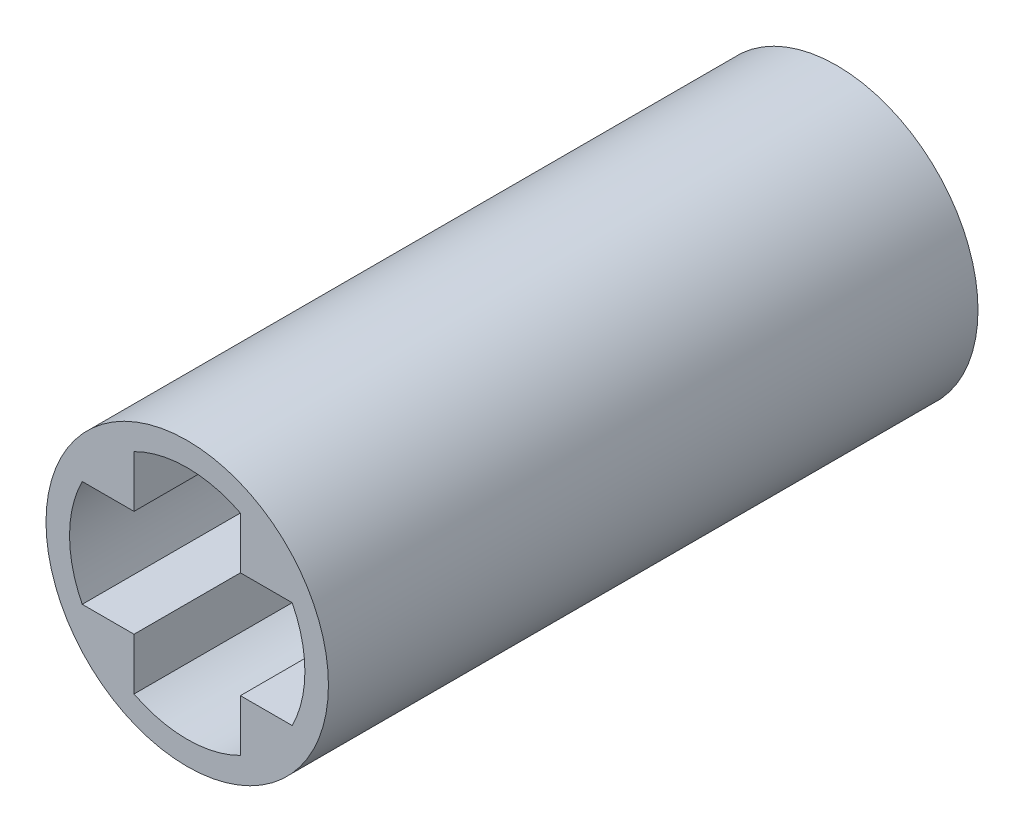
from build123d import *

# Parameters (mm, degrees)
SKETCH_1_R               = 3
SKETCH_1_R_2             = 1.5625
EXTRUDE_1_DEPTH          = 5
CUT_EXTRUDE_2_DEPTH      = 7.557438524
PATTERN_CIRCULAR_1_COUNT = 7
SKETCH_2_R               = 3
EXTRUDE_2_DEPTH          = 8.8
CUT_EXTRUDE_START        = 8.8
CUT_EXTRUDE_3_DEPTH      = 7.8


with BuildPart() as part:
    # 草图1 → 凸台-拉伸1 (new body)
    with BuildSketch(Plane.XY):
        Circle(SKETCH_1_R)
        Circle(SKETCH_1_R_2, mode=Mode.SUBTRACT)
    extrude(amount=EXTRUDE_1_DEPTH)

    # 草图1<3> → 切除-拉伸2 (cut, through all)
    with BuildSketch(Plane.XY):
        with BuildLine():
            Line((1.473941588, 0.729213103), (1.40047846, 0.692868192))
            ThreePointArc((1.40047846, 0.692868192), (1.521455528, 0.355779887), (1.5625, 0))
            ThreePointArc((1.5625, 0), (1.521455528, -0.355779887), (1.40047846, -0.692868192))
            Line((1.40047846, -0.692868192), (1.473941588, -0.729213103))
            add(Edge.make_bspline(
                [(1.473941588, -0.729213103), (1.485175683, -0.734771023), (1.517731995, -0.74785023), (1.58325759, -0.763025647), (1.69185053, -0.772739945), (1.833066262, -0.76334643), (2.010800821, -0.725727848), (2.210262557, -0.650798613), (2.403274907, -0.54458002), (2.544769721, -0.44101945), (2.63009006, -0.368231772), (2.666526001, -0.335104965)],
                knots=[0, 0, 0, 0, 0, 0.005604068, 0.015718248, 0.029959916, 0.048733667, 0.068727063, 0.096888892, 0.125050566, 0.147116643, 0.147116643, 0.147116643, 0.147116643, 0.147116643], degree=4))
            ThreePointArc((2.666526001, -0.335104965), (2.682251375, -0.167880349), (2.6875, 0))
            ThreePointArc((2.6875, 0), (2.682251375, 0.167880349), (2.666526001, 0.335104965))
            add(Edge.make_bspline(
                [(1.473941588, 0.729213103), (1.485175683, 0.734771023), (1.517731995, 0.74785023), (1.58325759, 0.763025647), (1.69185053, 0.772739945), (1.833066262, 0.76334643), (2.010800821, 0.725727848), (2.210262557, 0.650798613), (2.403274907, 0.54458002), (2.544769721, 0.44101945), (2.63009006, 0.368231772), (2.666526001, 0.335104965)],
                knots=[0, 0, 0, 0, 0, 0.005604068, 0.015718248, 0.029959916, 0.048733667, 0.068727063, 0.096888892, 0.125050566, 0.147116643, 0.147116643, 0.147116643, 0.147116643, 0.147116643], degree=4))
        make_face()
    cut_extrude_2 = extrude(amount=CUT_EXTRUDE_2_DEPTH, mode=Mode.SUBTRACT)

    # 阵列(圆周)1: 切除-拉伸2 ×7 about axis
    pattern_circular_1_axis = Axis((0, 0, 5), (0, 0, 1))
    for i in range(1, PATTERN_CIRCULAR_1_COUNT):
        add(cut_extrude_2.rotate(pattern_circular_1_axis, i * 360 / PATTERN_CIRCULAR_1_COUNT), mode=Mode.SUBTRACT)

    # 草图2 → 凸台-拉伸2 (add)
    with BuildSketch(Plane.XY.offset(5)):
        Circle(SKETCH_2_R)
    extrude(amount=EXTRUDE_2_DEPTH)

    # 草图2<4> → 切除-拉伸3 (cut)
    with BuildSketch(Plane.XY.offset(5).offset(CUT_EXTRUDE_START)):
        with BuildLine():
            ThreePointArc((1.130029762, 2.230029762), (0, 2.5), (-1.130029762, 2.230029762))
            Line((-1.130029762, 2.230029762), (-1.130029762, 1.130029762))
            Line((-1.130029762, 1.130029762), (-2.230029762, 1.130029762))
            ThreePointArc((-2.230029762, 1.130029762), (-2.5, 0), (-2.230029762, -1.130029762))
            Line((-2.230029762, -1.130029762), (-1.130029762, -1.130029762))
            Line((-1.130029762, -1.130029762), (-1.130029762, -2.230029762))
            ThreePointArc((-1.130029762, -2.230029762), (0, -2.5), (1.130029762, -2.230029762))
            Line((1.130029762, -2.230029762), (1.130029762, -1.130029762))
            Line((1.130029762, -1.130029762), (2.230029762, -1.130029762))
            ThreePointArc((2.230029762, -1.130029762), (2.5, 0), (2.230029762, 1.130029762))
            Line((2.230029762, 1.130029762), (1.130029762, 1.130029762))
            Line((1.130029762, 1.130029762), (1.130029762, 2.230029762))
        make_face()
    extrude(amount=-CUT_EXTRUDE_3_DEPTH, mode=Mode.SUBTRACT)


solid = part.part
